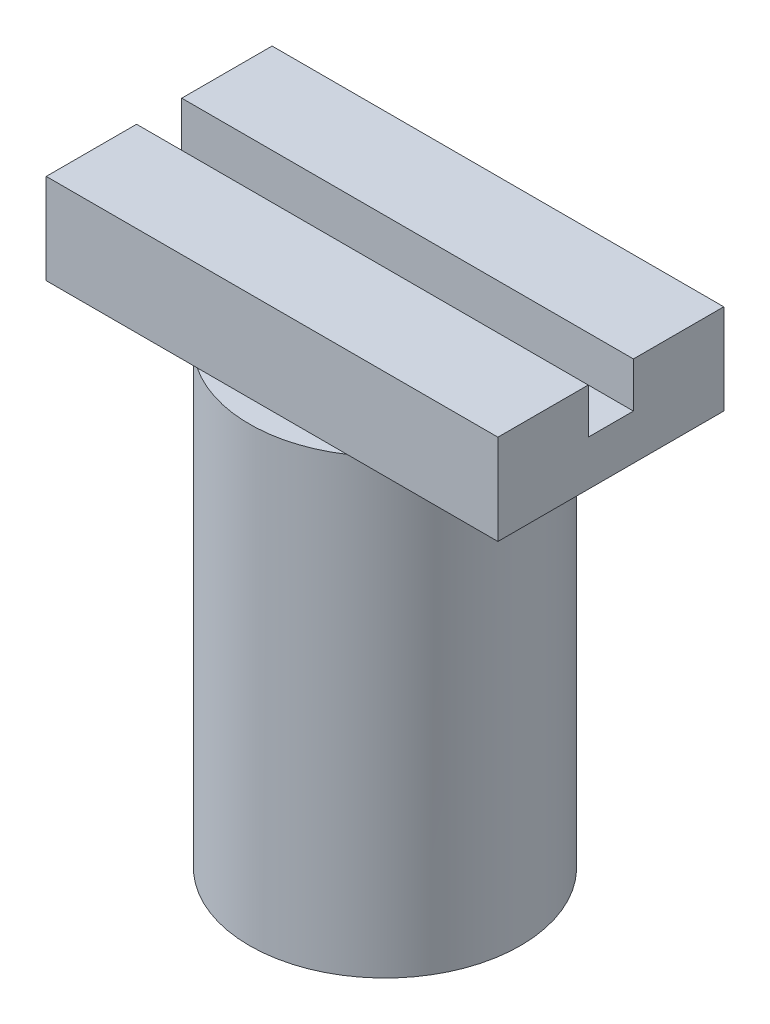
from build123d import *

# Parameters (mm, degrees)
SKETCH1_R           = 3
BOSS_EXTRUDE1_DEPTH = 10
SKETCH2_W           = 10
SKETCH2_H           = 5
BOSS_EXTRUDE2_DEPTH = 2
SKETCH3_W           = 10
SKETCH3_H           = 1
CUT_EXTRUDE1_DEPTH  = 1


with BuildPart() as part:
    # Sketch1 → Boss-Extrude1 (new body)
    with BuildSketch(Plane(origin=(0, 0, 0), x_dir=(1, 0, 0), z_dir=(0, 1, 0))):
        with Locations(Location((0, 0, 0), (0, 0, 270))):
            Circle(SKETCH1_R)
    extrude(amount=BOSS_EXTRUDE1_DEPTH)

    # Sketch2 → Boss-Extrude2 (add)
    with BuildSketch(Plane(origin=(0, 10, 0), x_dir=(1, 0, 0), z_dir=(0, 1, 0))):
        Rectangle(SKETCH2_W, SKETCH2_H)
    extrude(amount=BOSS_EXTRUDE2_DEPTH)

    # Sketch3 → Cut-Extrude1 (cut)
    with BuildSketch(Plane(origin=(0, 12, 0), x_dir=(1, 0, 0), z_dir=(0, 1, 0))):
        Rectangle(SKETCH3_W, SKETCH3_H)
    extrude(amount=-CUT_EXTRUDE1_DEPTH, mode=Mode.SUBTRACT)


solid = part.part
